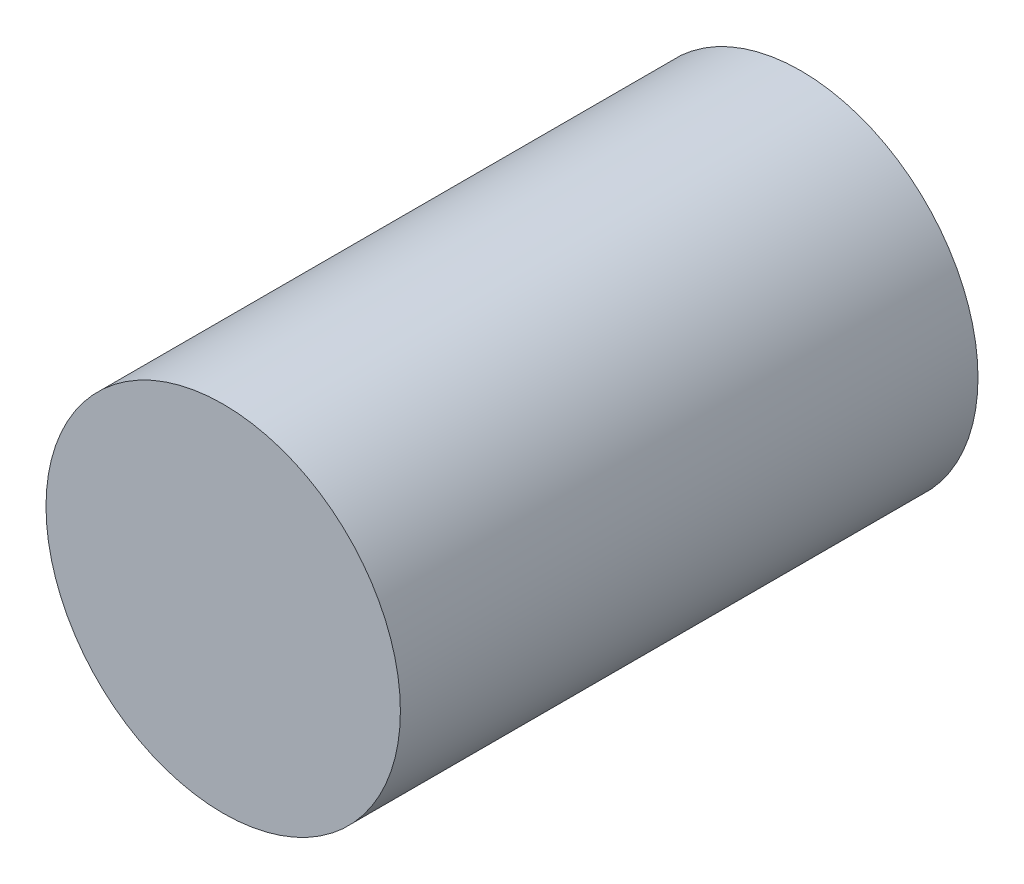
from build123d import *

# Parameters (mm, degrees)
SKETCH1_R      = 23.377006446
EXTRUDE1_DEPTH = 76.2


with BuildPart() as part:
    # Sketch1 → Extrude1 (new body)
    with BuildSketch(Plane.XY):
        with Locations(Location((0, 0, 0), (0, 0, 180))):
            Circle(SKETCH1_R)
    extrude(amount=EXTRUDE1_DEPTH)


solid = part.part
